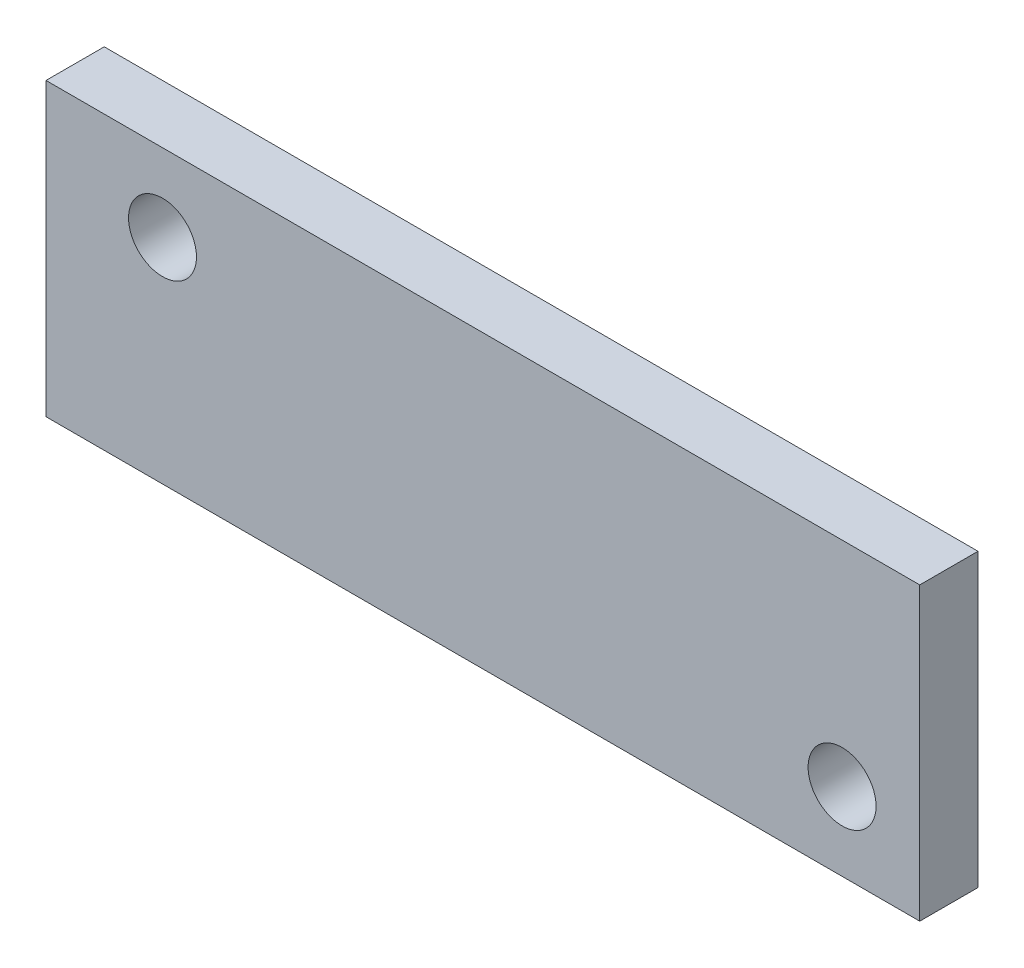
from build123d import *

# Parameters (mm, degrees)
SKETCH1_W           = 45
SKETCH1_H           = 15
BOSS_EXTRUDE1_DEPTH = 3
SKETCH3_R           = 1.75
CUT_EXTRUDE1_DEPTH  = 3


with BuildPart() as part:
    # Sketch1 → Boss-Extrude1 (new body)
    with BuildSketch(Plane.XY):
        Rectangle(SKETCH1_W, SKETCH1_H)
    extrude(amount=BOSS_EXTRUDE1_DEPTH)

    # Sketch3 → Cut-Extrude1 (cut)
    with BuildSketch(Plane.XY.offset(3)):
        with Locations((18.5, -3.5)):
            Circle(SKETCH3_R)
        with Locations((-16.5, 3.5)):
            Circle(SKETCH3_R)
    extrude(amount=-CUT_EXTRUDE1_DEPTH, mode=Mode.SUBTRACT)


solid = part.part
